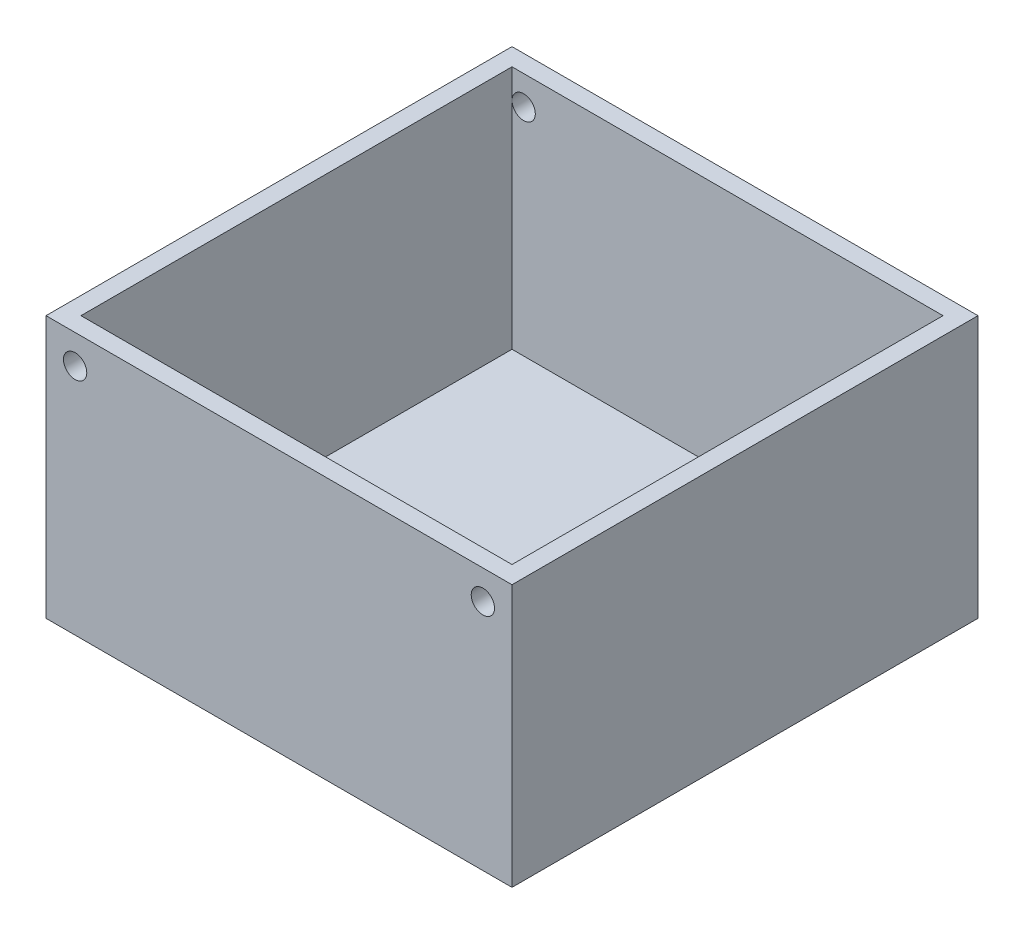
from build123d import *

# Parameters (mm, degrees)
BOSS_EXTRUDE1_DEPTH     = 80
SHELL1_T                = -3
CUT_EXTRUDE3_DEPTH      = 101.124921973
CUT_EXTRUDE3_DEPTH_BACK = 101.124921973
SKETCH1_3_R             = 2


with BuildPart() as part:
    # Sketch1 → Boss-Extrude1 (new body)
    with BuildSketch(Plane.XY):
        Polygon((-40, 0), (40, 0), (40, 45), (35, 45), (-40, 45), align=None)
    extrude(amount=BOSS_EXTRUDE1_DEPTH)

    # Shell1
    shell1_openings = [part.faces().sort_by_distance(p)[0] for p in [
        (0, 45, 40),
    ]]
    offset(amount=SHELL1_T, openings=shell1_openings, kind=Kind.INTERSECTION)

    # Sketch1<3> → Cut-Extrude3 (cut, two sides: drawn at the far end of the back side and taken through both)
    with BuildSketch(Plane.XY.offset(-CUT_EXTRUDE3_DEPTH_BACK)):
        with Locations((35, 40)):
            Circle(SKETCH1_3_R)
        with Locations((-35, 40)):
            Circle(SKETCH1_3_R)
    extrude(amount=CUT_EXTRUDE3_DEPTH + CUT_EXTRUDE3_DEPTH_BACK, mode=Mode.SUBTRACT)


solid = part.part
